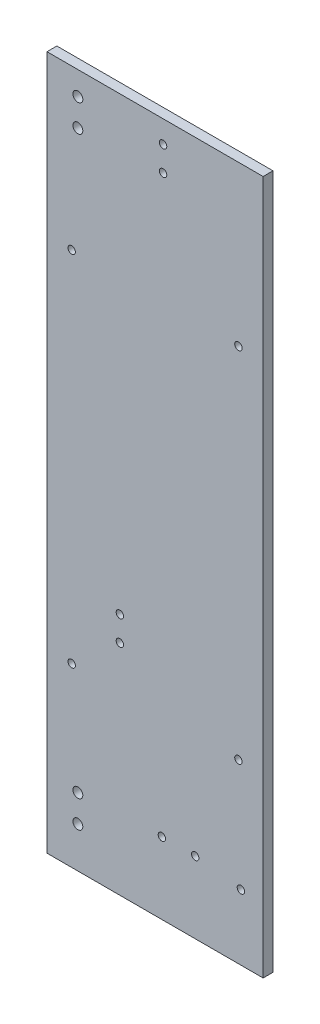
from build123d import *

# Parameters (mm, degrees)
ESQUISSE1_W      = 87.5
ESQUISSE1_H      = 281
ESQUISSE1_R      = 1.5
ESQUISSE1_R_2    = 2
EXTRUSION1_DEPTH = 4


with BuildPart() as part:
    # Esquisse1 → Extrusion1 (new body)
    with BuildSketch(Plane.XY):
        with Locations((26.659208357, -106.319578947)):
            Rectangle(ESQUISSE1_W, ESQUISSE1_H)
        with Locations((-7.090791643, -175.319578947)):
            Circle(ESQUISSE1_R, mode=Mode.SUBTRACT)
        with Locations((-7.090791643, -30.319578947)):
            Circle(ESQUISSE1_R, mode=Mode.SUBTRACT)
        with Locations((60.409208357, -30.319578947)):
            Circle(ESQUISSE1_R, mode=Mode.SUBTRACT)
        with Locations((60.409208357, -175.319578947)):
            Circle(ESQUISSE1_R, mode=Mode.SUBTRACT)
        with Locations((42.909208357, -217.819578947)):
            Circle(ESQUISSE1_R, mode=Mode.SUBTRACT)
        with Locations((29.409208357, -217.819578947)):
            Circle(ESQUISSE1_R, mode=Mode.SUBTRACT)
        with Locations((61.409208357, -220.319578947)):
            Circle(ESQUISSE1_R, mode=Mode.SUBTRACT)
        with Locations((-4.590791643, -219.319578947)):
            Circle(ESQUISSE1_R_2, mode=Mode.SUBTRACT)
        with Locations((-4.590791643, -230.319578947)):
            Circle(ESQUISSE1_R_2, mode=Mode.SUBTRACT)
        with Locations((-4.590791643, 24.680421053)):
            Circle(ESQUISSE1_R_2, mode=Mode.SUBTRACT)
        with Locations((-4.590791643, 13.680421053)):
            Circle(ESQUISSE1_R_2, mode=Mode.SUBTRACT)
        with Locations((29.909208357, 25.180421053)):
            Circle(ESQUISSE1_R, mode=Mode.SUBTRACT)
        with Locations((29.909208357, 15.180421053)):
            Circle(ESQUISSE1_R, mode=Mode.SUBTRACT)
        with Locations((12.409208357, -148.319578947)):
            Circle(ESQUISSE1_R, mode=Mode.SUBTRACT)
        with Locations((12.409208357, -158.319578947)):
            Circle(ESQUISSE1_R, mode=Mode.SUBTRACT)
    extrude(amount=EXTRUSION1_DEPTH)


solid = part.part
